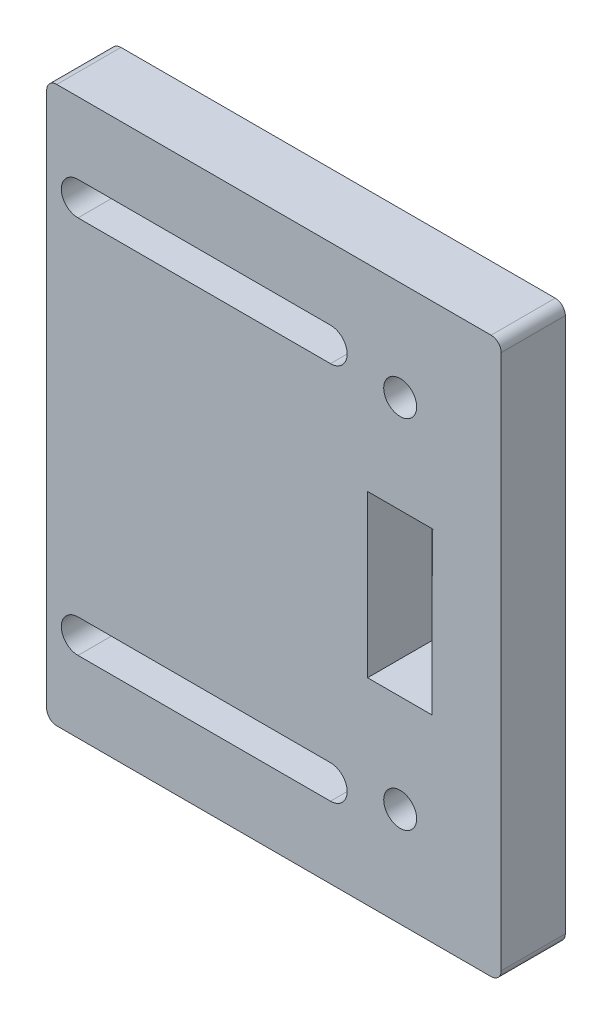
from build123d import *

# Parameters (mm, degrees)
SKETCH1_W                                        = 90
SKETCH1_H                                        = 110
BOSS_EXTRUDE2_DEPTH                              = 12.7
CSK_FOR_1_4_FLAT_HEAD_MACHINE_SCREW3_D           = 6.5278
CSK_FOR_1_4_FLAT_HEAD_MACHINE_SCREW3_CSINK_D     = 12.8778
CSK_FOR_1_4_FLAT_HEAD_MACHINE_SCREW3_CSINK_ANGLE = 82
CSK_FOR_1_4_FLAT_HEAD_MACHINE_SCREW4_D           = 6.5278
CSK_FOR_1_4_FLAT_HEAD_MACHINE_SCREW4_CSINK_D     = 12.8778
CSK_FOR_1_4_FLAT_HEAD_MACHINE_SCREW4_CSINK_ANGLE = 82
FILLET1_R                                        = 2
CUT_EXTRUDE1_DEPTH                               = 143.692992119


with BuildPart() as part:
    # Sketch1 → Boss-Extrude2 (new body)
    with BuildSketch(Plane.XY):
        with Locations((45, -55)):
            Rectangle(SKETCH1_W, SKETCH1_H)
        Polygon((70, -39.025625978), (76.45, -39.025625978), (76.25, -55), (76.25, -70.975625978), (70, -70.975625978), (63.55, -70.975625978), (63.55, -39.025625978), align=None, mode=Mode.SUBTRACT)
    extrude(amount=BOSS_EXTRUDE2_DEPTH)

    # CSK for 1/4 Flat Head Machine Screw3 (through all)
    with Locations(Plane(origin=(0, 0, 0), x_dir=(-1, 0, 0), z_dir=(0, 0, -1))):
        with Locations((-70, -90.31)):
            CounterSinkHole(CSK_FOR_1_4_FLAT_HEAD_MACHINE_SCREW3_D / 2, CSK_FOR_1_4_FLAT_HEAD_MACHINE_SCREW3_CSINK_D / 2, counter_sink_angle=CSK_FOR_1_4_FLAT_HEAD_MACHINE_SCREW3_CSINK_ANGLE)

    # CSK for 1/4 Flat Head Machine Screw4 (through all)
    with Locations(Plane(origin=(0, 0, 0), x_dir=(-1, 0, 0), z_dir=(0, 0, -1))):
        with Locations((-70, -19.69)):
            CounterSinkHole(CSK_FOR_1_4_FLAT_HEAD_MACHINE_SCREW4_D / 2, CSK_FOR_1_4_FLAT_HEAD_MACHINE_SCREW4_CSINK_D / 2, counter_sink_angle=CSK_FOR_1_4_FLAT_HEAD_MACHINE_SCREW4_CSINK_ANGLE)

    # Fillet1
    fillet1_edges = [part.edges().sort_by_distance(p)[0] for p in [
        (0, 0, 6.35),
        (90, 0, 6.35),
        (90, -110, 6.35),
        (0, -110, 6.35),
    ]]
    fillet(fillet1_edges, radius=FILLET1_R)

    # Sketch15 → Cut-Extrude1 (cut, through all)
    with BuildSketch(Plane(origin=(0, 0, 0), x_dir=(-1, 0, 0), z_dir=(0, 0, -1))):
        with BuildLine():
            Line((-56.200253658, -14.185), (-6.200253658, -14.185))
            ThreePointArc((-6.200253658, -14.185), (-2.900253658, -17.485), (-6.200253658, -20.785))
            Line((-6.200253658, -20.785), (-56.200253658, -20.785))
            ThreePointArc((-56.200253658, -20.785), (-59.500253658, -17.485), (-56.200253658, -14.185))
        make_face()
        with BuildLine():
            Line((-56.200253658, -89.215), (-6.200253658, -89.215))
            ThreePointArc((-6.200253658, -89.215), (-2.900253658, -92.515), (-6.200253658, -95.815))
            Line((-6.200253658, -95.815), (-56.200253658, -95.815))
            ThreePointArc((-56.200253658, -95.815), (-59.500253658, -92.515), (-56.200253658, -89.215))
        make_face()
    extrude(amount=-CUT_EXTRUDE1_DEPTH, mode=Mode.SUBTRACT)


solid = part.part
